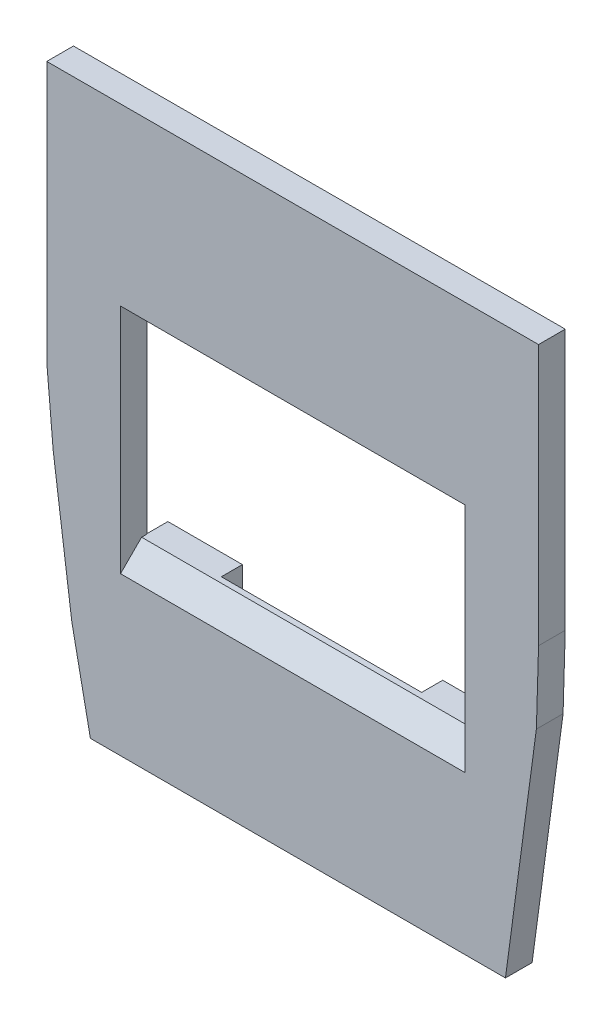
from build123d import *

# Parameters (mm, degrees)
SKETCH1_W           = 24.499964053
SKETCH1_H           = 13.5
BOSS_EXTRUDE1_DEPTH = 1.9
CHAMFER2_SIZE       = 1.5
SKETCH3_W           = 4.970239213
SKETCH3_H           = 5
SKETCH3_W_2         = 5.304118475
SKETCH3_H_2         = 3.940048439
SKETCH3_H_3         = 4.081751912
BOSS_EXTRUDE4_DEPTH = 1.5


with BuildPart() as part:
    # Sketch1 → Boss-Extrude1 (new body)
    with BuildSketch(Plane.XY):
        Polygon((5.471235903, 20.676320824), (40.471199956, 20.726483376), (40.471199956, 2.164736428), (40.316871719, -3.053294073), (39.006131301, -12.842886574), (38.115574665, -19.494231445), (37.577206439, -19.494231445), (8.577206439, -19.494231445), (7.251992344, -12.950986849), (5.926778248, -3.053294073), (5.471235903, 2.164736428), align=None)
        with Locations((22.971217929, -0.023516624)):
            Rectangle(SKETCH1_W, SKETCH1_H, mode=Mode.SUBTRACT)
    extrude(amount=BOSS_EXTRUDE1_DEPTH)

    # Chamfer2
    chamfer2_edges = [part.edges().sort_by_distance(p)[0] for p in [
        (22.971217929, 6.726483376, 1.9),
        (22.971217929, -6.773516624, 1.9),
    ]]
    chamfer(chamfer2_edges, length=CHAMFER2_SIZE)

    # Sketch3 → Boss-Extrude4 (add)
    with BuildSketch(Plane(origin=(0, 0, 0), x_dir=(-1, 0, 0), z_dir=(0, 0, -1))):
        with Locations((-32.736080349, -9.273516624)):
            Rectangle(SKETCH3_W, SKETCH3_H)
        with Locations((-13.343741273, -9.273516624)):
            Rectangle(SKETCH3_W_2, SKETCH3_H)
        with Locations((-32.736080349, 12.652087829)):
            Rectangle(SKETCH3_W, SKETCH3_H_2)
        with Locations((-13.343741273, 12.581236092)):
            Rectangle(SKETCH3_W_2, SKETCH3_H_3)
    extrude(amount=BOSS_EXTRUDE4_DEPTH)


solid = part.part
